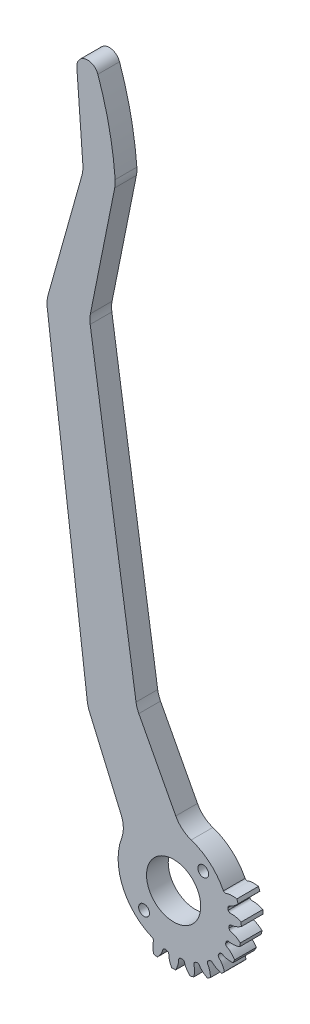
from build123d import *

# Parameters (mm, degrees)
SKETCH_1_R               = 12.5
EXTRUDE_1_DEPTH          = 4
CUT_EXTRUDE_1_DEPTH      = 19.12456896
PATTERN_CIRCULAR_1_COUNT = 23
EXTRUDE_2_DEPTH          = 4
CUT_EXTRUDE_START        = -10
CUT_EXTRUDE_2_DEPTH      = 10
FILLET_1_R               = 5
SKETCH_6_R               = 5
CUT_EXTRUDE_3_DEPTH      = 10
SKETCH_7_R               = 1
CUT_EXTRUDE_4_DEPTH      = 10


with BuildPart() as part:
    # 草图1 → 凸台-拉伸1 (new body)
    with BuildSketch(Plane.XY):
        Circle(SKETCH_1_R)
    extrude(amount=EXTRUDE_1_DEPTH)

    # 草图2 → 切除-拉伸1 (cut, through all)
    with BuildSketch(Plane.XY):
        with BuildLine():
            ThreePointArc((0.181377653, 10.248395101), (0, 10.25), (-0.181377653, 10.248395101))
            add(Edge.make_bspline(
                [(-0.181377653, 10.248395101), (-0.577733486, 10.366762974), (-0.543760308, 10.63383717), (-0.592929934, 10.897175969), (-0.599497923, 10.928924648), (-0.607662079, 10.964750021), (-0.617581589, 11.004600593), (-0.629422247, 11.048418382), (-0.643345631, 11.096140951), (-0.659512363, 11.147700822), (-0.678080917, 11.203025719), (-0.699207817, 11.262038556), (-0.723047409, 11.324657509), (-0.749751766, 11.390796064), (-0.77947055, 11.460363083), (-0.812350892, 11.53326286), (-0.848537271, 11.609395193), (-0.888171388, 11.688655445), (-0.931392054, 11.77093462), (-0.978335067, 11.85611944), (-1.029133098, 11.944092416), (-1.083915577, 12.034731933), (-1.142808585, 12.127912332), (-1.205934738, 12.223503996), (-1.273413083, 12.321373437), (-1.345358995, 12.421383392), (-1.42188407, 12.523392912), (-1.503096023, 12.627257463), (-1.589098596, 12.732829022), (-1.679991457, 12.839956181), (-1.775870106, 12.94848425), (-1.876825788, 13.058255364), (-1.982945401, 13.169108593), (-2.094311412, 13.28088005), (-2.211001774, 13.393403009), (-2.333089845, 13.506508017), (-2.460644312, 13.620023012), (-2.59372912, 13.733773443), (-2.732403367, 13.847582394), (-2.927091206, 14.000950144), (-3.078290454, 14.112796156), (-3.181680766, 14.186195552)],
                knots=[0, 0, 0, 0, 0.147386897, 0.152959532, 0.159389495, 0.166676786, 0.174821406, 0.183823355, 0.193682632, 0.204399237, 0.21597317, 0.228404432, 0.241693023, 0.255838942, 0.270842189, 0.286702764, 0.303420668, 0.320995901, 0.339428462, 0.358718351, 0.378865568, 0.399870114, 0.421731989, 0.444451192, 0.468027723, 0.492461582, 0.517752771, 0.543901287, 0.570907132, 0.598770305, 0.627490807, 0.657068637, 0.687503795, 0.718796282, 0.750946098, 0.783953241, 0.817817713, 0.852539514, 0.888118643, 0.9245551, 1, 1, 1, 1], degree=3))
            ThreePointArc((-3.181680766, 14.186195552), (0, 14.538611926), (3.181680766, 14.186195552))
            add(Edge.make_bspline(
                [(0.181377653, 10.248395101), (0.577733486, 10.366762974), (0.543760308, 10.63383717), (0.592929934, 10.897175969), (0.599497923, 10.928924648), (0.607662079, 10.964750021), (0.617581589, 11.004600593), (0.629422247, 11.048418382), (0.643345631, 11.096140951), (0.659512363, 11.147700822), (0.678080917, 11.203025719), (0.699207817, 11.262038556), (0.723047409, 11.324657509), (0.749751766, 11.390796064), (0.77947055, 11.460363083), (0.812350892, 11.53326286), (0.848537271, 11.609395193), (0.888171388, 11.688655445), (0.931392054, 11.77093462), (0.978335067, 11.85611944), (1.029133098, 11.944092416), (1.083915577, 12.034731933), (1.142808585, 12.127912332), (1.205934738, 12.223503996), (1.273413083, 12.321373437), (1.345358995, 12.421383392), (1.42188407, 12.523392912), (1.503096023, 12.627257463), (1.589098596, 12.732829022), (1.679991457, 12.839956181), (1.775870106, 12.94848425), (1.876825788, 13.058255364), (1.982945401, 13.169108593), (2.094311412, 13.28088005), (2.211001774, 13.393403009), (2.333089845, 13.506508017), (2.460644312, 13.620023012), (2.59372912, 13.733773443), (2.732403367, 13.847582394), (2.927091206, 14.000950144), (3.078290454, 14.112796156), (3.181680766, 14.186195552)],
                knots=[0, 0, 0, 0, 0.147386897, 0.152959532, 0.159389495, 0.166676786, 0.174821406, 0.183823355, 0.193682632, 0.204399237, 0.21597317, 0.228404432, 0.241693023, 0.255838942, 0.270842189, 0.286702764, 0.303420668, 0.320995901, 0.339428462, 0.358718351, 0.378865568, 0.399870114, 0.421731989, 0.444451192, 0.468027723, 0.492461582, 0.517752771, 0.543901287, 0.570907132, 0.598770305, 0.627490807, 0.657068637, 0.687503795, 0.718796282, 0.750946098, 0.783953241, 0.817817713, 0.852539514, 0.888118643, 0.9245551, 1, 1, 1, 1], degree=3))
        make_face()
    cut_extrude_1 = extrude(amount=CUT_EXTRUDE_1_DEPTH, mode=Mode.SUBTRACT)

    # 阵列(圆周)1: 切除-拉伸1 ×23 about axis
    pattern_circular_1_axis = Axis((0, 0, 4), (0, 0, -1))
    for i in range(1, PATTERN_CIRCULAR_1_COUNT):
        add(cut_extrude_1.rotate(pattern_circular_1_axis, i * 360 / PATTERN_CIRCULAR_1_COUNT), mode=Mode.SUBTRACT)

    # 草图4 → 凸台-拉伸2 (add)
    with BuildSketch(Plane.XY.offset(4)):
        with BuildLine():
            Line((-6.819349946, 25.835952979), (-15.536781983, 83.663662397))
            Line((-15.536781983, 83.663662397), (-10.743091109, 107.538765073))
            ThreePointArc((-10.743091109, 107.538765073), (-11.82067905, 115.622881102), (-13.984620963, 123.486180864))
            ThreePointArc((-13.984620963, 123.486180864), (-16.2799033, 124.783737603), (-17.866966929, 122.678220199))
            Line((-17.866966929, 122.678220199), (-16.687208025, 106.7217742))
            Line((-16.687208025, 106.7217742), (-23.462271204, 82.574341232))
            Line((-23.462271204, 82.574341232), (-15.839885775, 21.519712327))
            Line((-15.839885775, 21.519712327), (-5.507385757, -2.380903635))
            ThreePointArc((-5.507385757, -2.380903635), (2.589744391, -5.412321497), (5.309341465, 2.794797525))
            Line((5.309341465, 2.794797525), (-6.819349946, 25.835952979))
        make_face()
    extrude(amount=-EXTRUDE_2_DEPTH)

    # 草图5 → 切除-拉伸2 (cut)
    with BuildSketch(Plane.XY.offset(4).offset(CUT_EXTRUDE_START)):
        with BuildLine():
            Line((-4.083611171, -9.40141584), (-5.976016348, -13.758169523))
            ThreePointArc((-5.976016348, -13.758169523), (-14.68623421, -3.051970629), (-10.962721322, 10.238102423))
            Line((-10.962721322, 10.238102423), (-8.805090093, 5.247179095))
            ThreePointArc((-8.805090093, 5.247179095), (-9.755766934, -3.144441371), (-4.083611171, -9.40141584))
        make_face()
        with BuildLine():
            Line((9.182844039, 4.553885742), (13.43830835, 6.664223037))
            ThreePointArc((13.43830835, 6.664223037), (7.43629305, 13.026954582), (-1.094344147, 14.960027102))
            Line((-1.094344147, 14.960027102), (1.438367515, 10.1485762))
            ThreePointArc((1.438367515, 10.1485762), (6.002305728, 8.308719874), (9.182844039, 4.553885742))
        make_face()
    extrude(amount=CUT_EXTRUDE_2_DEPTH, mode=Mode.SUBTRACT)

    # 圆角1
    fillet_1_edges = [part.edges().sort_by_distance(p)[0] for p in [
        (-16.687208025, 106.7217742, 2),
        (-10.743091109, 107.538765073, 2),
        (-15.536781983, 83.663662397, 2),
        (-23.462271204, 82.574341232, 2),
        (-15.839885775, 21.519712327, 2),
        (-6.819349946, 25.835952979, 2),
        (1.438367515, 10.1485762, 2),
        (-8.805090093, 5.247179095, 2),
    ]]
    fillet(fillet_1_edges, radius=FILLET_1_R)

    # 草图6 → 切除-拉伸3 (cut)
    with BuildSketch(Plane(origin=(0, 0, 0), x_dir=(-1, 0, 0), z_dir=(0, 0, -1))):
        Circle(SKETCH_6_R)
    extrude(amount=-CUT_EXTRUDE_3_DEPTH, mode=Mode.SUBTRACT)

    # 草图7 → 切除-拉伸4 (cut)
    with BuildSketch(Plane.XY.offset(4)):
        with Locations((-5.460425146, -5.846687714)):
            Circle(SKETCH_7_R)
        with Locations((5.460425146, 5.846687714)):
            Circle(SKETCH_7_R)
    extrude(amount=-CUT_EXTRUDE_4_DEPTH, mode=Mode.SUBTRACT)


solid = part.part
